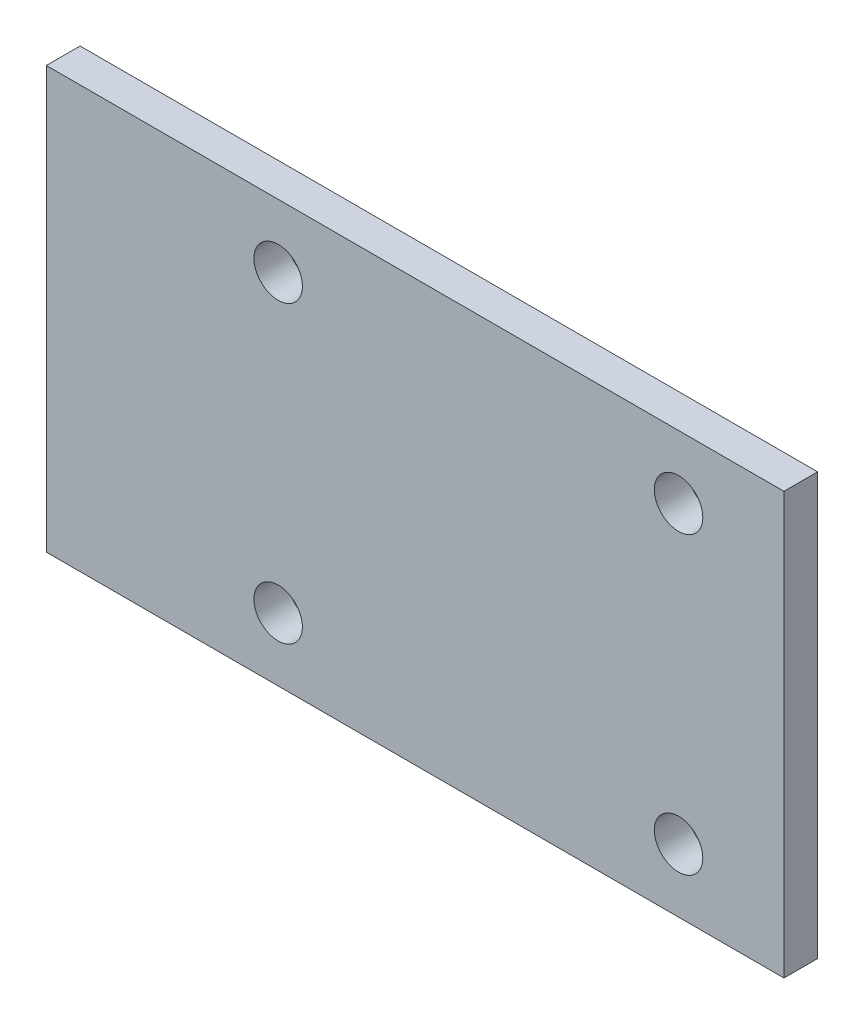
from build123d import *

# Parameters (mm, degrees)
SKETCH1_W   = 35
SKETCH1_H   = 20
PCB_DEPTH   = 1.6
HOLES_REACH = 22.219
SKETCH2_R   = 1.15


with BuildPart() as part:
    # Sketch1 → PCB (new body)
    with BuildSketch(Plane.XY):
        Rectangle(SKETCH1_W, SKETCH1_H)
    extrude(amount=PCB_DEPTH)

    # Sketch2 → Holes (cut, up to next)
    with BuildSketch(Plane.XY, mode=Mode.PRIVATE) as holes_sk1:
        with Locations((12.5, 7)):
            Circle(SKETCH2_R)
    holes_tool1 = extrude(holes_sk1.sketch, amount=HOLES_REACH, mode=Mode.PRIVATE) & part.part
    # Sketch2 → Holes (cut, up to next)
    with BuildSketch(Plane.XY, mode=Mode.PRIVATE) as holes_sk2:
        with Locations((-6.5, 7)):
            Circle(SKETCH2_R)
    holes_tool2 = extrude(holes_sk2.sketch, amount=HOLES_REACH, mode=Mode.PRIVATE) & part.part
    # Sketch2 → Holes (cut, up to next)
    with BuildSketch(Plane.XY, mode=Mode.PRIVATE) as holes_sk3:
        with Locations((-6.5, -7)):
            Circle(SKETCH2_R)
    holes_tool3 = extrude(holes_sk3.sketch, amount=HOLES_REACH, mode=Mode.PRIVATE) & part.part
    # Sketch2 → Holes (cut, up to next)
    with BuildSketch(Plane.XY, mode=Mode.PRIVATE) as holes_sk4:
        with Locations((12.5, -7)):
            Circle(SKETCH2_R)
    holes_tool4 = extrude(holes_sk4.sketch, amount=HOLES_REACH, mode=Mode.PRIVATE) & part.part
    add(holes_tool1.solids().sort_by_distance((12.5, 7, 0))[0], mode=Mode.SUBTRACT)
    add(holes_tool2.solids().sort_by_distance((-6.5, 7, 0))[0], mode=Mode.SUBTRACT)
    add(holes_tool3.solids().sort_by_distance((-6.5, -7, 0))[0], mode=Mode.SUBTRACT)
    add(holes_tool4.solids().sort_by_distance((12.5, -7, 0))[0], mode=Mode.SUBTRACT)


solid = part.part
